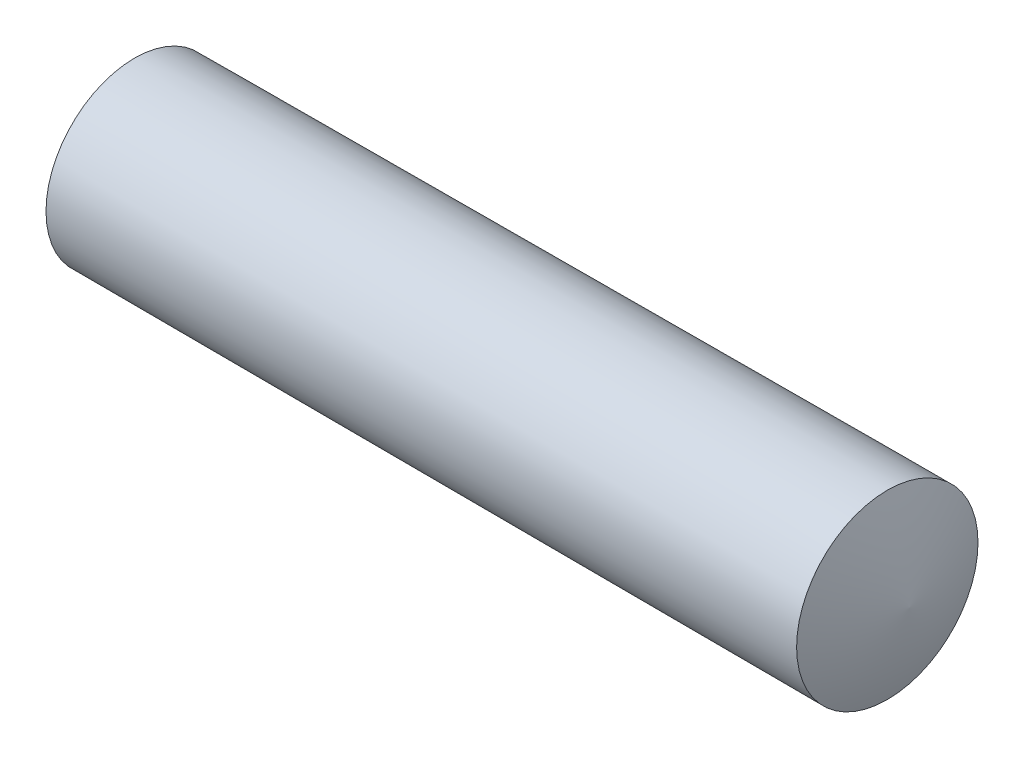
from build123d import *


with BuildPart() as part:
    # 草图1 → Revolve 599 (revolve)
    with BuildSketch(Plane.XY):
        with BuildLine():
            Line((-2.82, 0), (15.18, 0))
            ThreePointArc((15.18, 0), (14.995439478, -1.040077362), (14.68, -2.048205053))
            Line((14.68, -2.048205053), (-2.32, -2))
            ThreePointArc((-2.32, -2), (-2.634693151, -1.016173288), (-2.82, 0))
        make_face()
    revolve(axis=Axis((0, 0, 0), (1, 0, 0)))


solid = part.part
